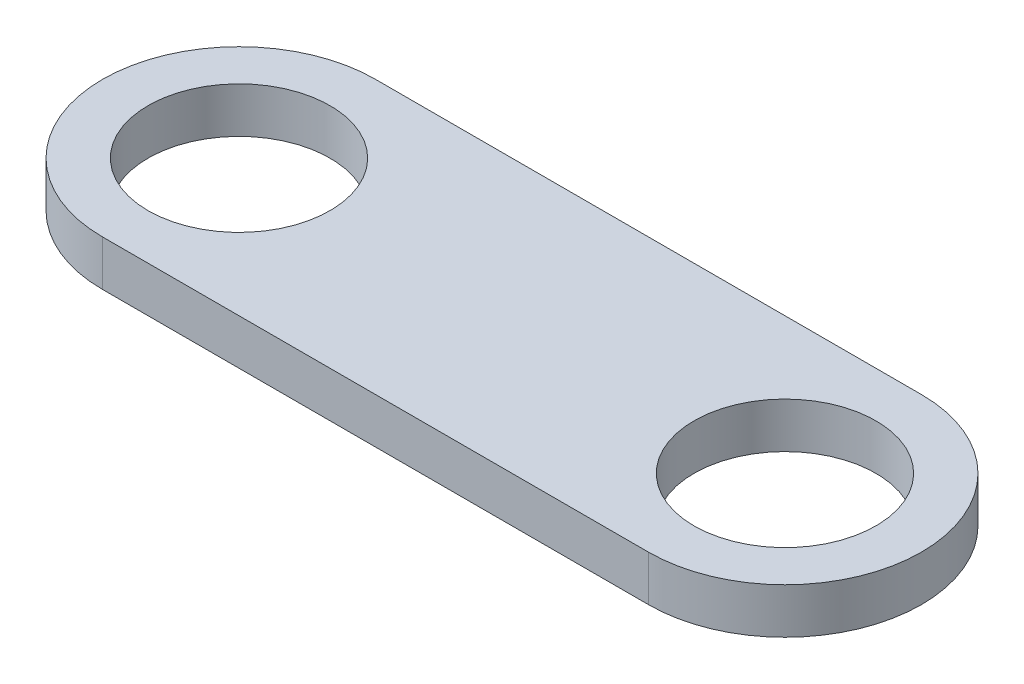
from build123d import *

# Parameters (mm, degrees)
SKETCH2_R           = 6.35
BOSS_EXTRUDE1_DEPTH = 3.175


with BuildPart() as part:
    # Sketch2 → Boss-Extrude1 (new body)
    with BuildSketch(Plane(origin=(0, 0, 0), x_dir=(1, 0, 0), z_dir=(0, 1, 0))):
        with BuildLine():
            Line((0, 9.525), (38.1, 9.525))
            ThreePointArc((38.1, 9.525), (47.625, 0), (38.1, -9.525))
            Line((38.1, -9.525), (0, -9.525))
            ThreePointArc((0, -9.525), (-9.525, 0), (0, 9.525))
        make_face()
        with Locations(Location((0, 0, 0), (0, 0, 270))):
            Circle(SKETCH2_R, mode=Mode.SUBTRACT)
        with Locations(Location((38.1, 0, 0), (0, 0, 270))):
            Circle(SKETCH2_R, mode=Mode.SUBTRACT)
    extrude(amount=BOSS_EXTRUDE1_DEPTH)


solid = part.part
